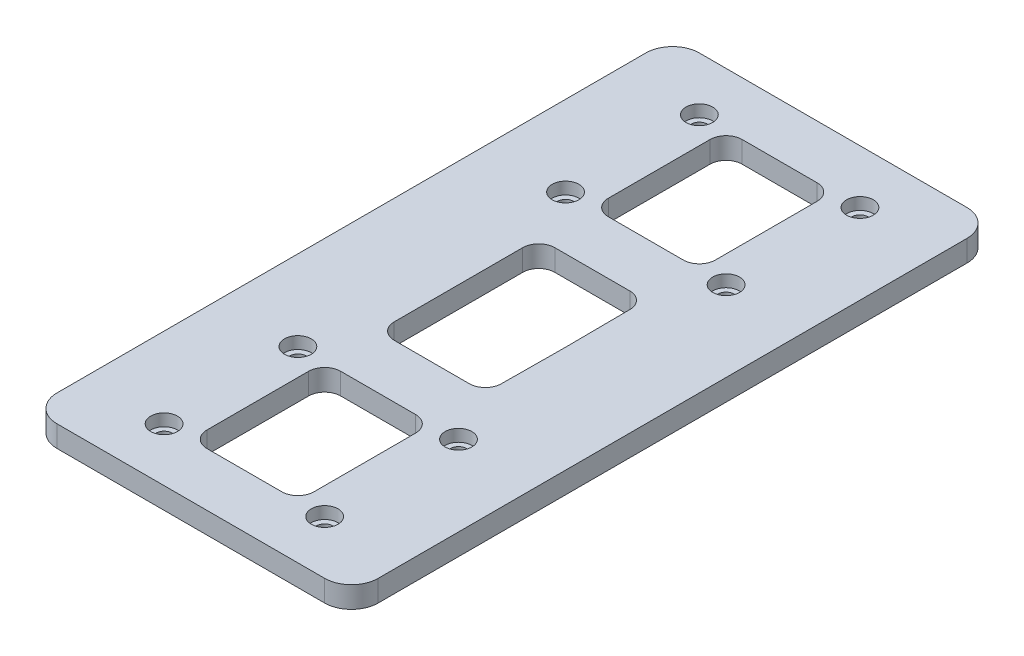
from build123d import *

# Parameters (mm, degrees)
SKETCH_1_R      = 2.5
EXTRUDE_1_DEPTH = 4
SKETCH_1_32_R   = 2.5
SKETCH_1_32_R_2 = 1.5
EXTRUDE_2_DEPTH = 1.75
SKETCH_1_33_R   = 2.5
SKETCH_1_33_R_2 = 1.5
EXTRUDE_3_DEPTH = 1.75


with BuildPart() as part:
    # 草图1 → 凸台-拉伸1 (new body)
    with BuildSketch(Plane(origin=(0, 0, 0), x_dir=(1, 0, 0), z_dir=(0, 1, 0))):
        with BuildLine():
            Line((-174.840079727, 131.119726246), (-199.840079727, 131.119726246))
            Line((-199.840079727, 131.119726246), (-224.840079727, 131.119726246))
            ThreePointArc((-224.840079727, 131.119726246), (-228.375613633, 129.655260152), (-229.840079727, 126.119726246))
            Line((-229.840079727, 126.119726246), (-229.840079727, 16.119726246))
            ThreePointArc((-229.840079727, 16.119726246), (-228.375613633, 12.58419234), (-224.840079727, 11.119726246))
            Line((-224.840079727, 11.119726246), (-199.840079727, 11.119726246))
            Line((-199.840079727, 11.119726246), (-174.840079727, 11.119726246))
            ThreePointArc((-174.840079727, 11.119726246), (-171.304545821, 12.58419234), (-169.840079727, 16.119726246))
            Line((-169.840079727, 16.119726246), (-169.840079727, 126.119726246))
            ThreePointArc((-169.840079727, 126.119726246), (-171.304545821, 129.655260152), (-174.840079727, 131.119726246))
        make_face()
        with Locations((-214.840082087, 21.119726246)):
            Circle(SKETCH_1_R, mode=Mode.SUBTRACT)
        with BuildLine():
            ThreePointArc((-192.840079727, 46.119726246), (-190.718759384, 45.241046589), (-189.840079727, 43.119726246))
            Line((-189.840079727, 43.119726246), (-189.840079727, 24.119726246))
            ThreePointArc((-189.840079727, 24.119726246), (-190.718759384, 21.998405902), (-192.840079727, 21.119726246))
            Line((-192.840079727, 21.119726246), (-206.840082087, 21.119726246))
            ThreePointArc((-206.840082087, 21.119726246), (-208.961402431, 21.998405902), (-209.840082087, 24.119726246))
            Line((-209.840082087, 24.119726246), (-209.840082087, 43.119726246))
            ThreePointArc((-209.840082087, 43.119726246), (-208.961402431, 45.241046589), (-206.840082087, 46.119726246))
            Line((-206.840082087, 46.119726246), (-192.840079727, 46.119726246))
        make_face(mode=Mode.SUBTRACT)
        with Locations((-214.840082087, 46.119726246)):
            Circle(SKETCH_1_R, mode=Mode.SUBTRACT)
        with Locations((-184.840079727, 21.119726246)):
            Circle(SKETCH_1_R, mode=Mode.SUBTRACT)
        with BuildLine():
            ThreePointArc((-206.840082087, 56.119726246), (-208.961402431, 56.998405902), (-209.840082087, 59.119726246))
            Line((-209.840082087, 59.119726246), (-209.840082087, 83.119726246))
            ThreePointArc((-209.840082087, 83.119726246), (-208.961402431, 85.241046589), (-206.840082087, 86.119726246))
            Line((-206.840082087, 86.119726246), (-192.818063372, 86.119726246))
            ThreePointArc((-192.818063372, 86.119726246), (-190.704569987, 85.248844775), (-189.818144754, 83.141823385))
            Line((-189.818144754, 83.141823385), (-189.729591033, 71.119726246))
            Line((-189.729591033, 71.119726246), (-189.818144754, 59.097629106))
            ThreePointArc((-189.818144754, 59.097629106), (-190.704569987, 56.990607717), (-192.818063372, 56.119726246))
            Line((-192.818063372, 56.119726246), (-206.840082087, 56.119726246))
        make_face(mode=Mode.SUBTRACT)
        with Locations((-184.840079727, 46.119726246)):
            Circle(SKETCH_1_R, mode=Mode.SUBTRACT)
        with Locations((-214.840082087, 96.119726246)):
            Circle(SKETCH_1_R, mode=Mode.SUBTRACT)
        with Locations((-214.840082087, 121.119726246)):
            Circle(SKETCH_1_R, mode=Mode.SUBTRACT)
        with BuildLine():
            Line((-192.840079727, 96.119726246), (-206.840082087, 96.119726246))
            ThreePointArc((-206.840082087, 96.119726246), (-208.961402431, 96.998405902), (-209.840082087, 99.119726246))
            Line((-209.840082087, 99.119726246), (-209.840082087, 118.119726246))
            ThreePointArc((-209.840082087, 118.119726246), (-208.961402431, 120.241046589), (-206.840082087, 121.119726246))
            Line((-206.840082087, 121.119726246), (-192.840079727, 121.119726246))
            ThreePointArc((-192.840079727, 121.119726246), (-190.718759384, 120.241046589), (-189.840079727, 118.119726246))
            Line((-189.840079727, 118.119726246), (-189.840079727, 99.119726246))
            ThreePointArc((-189.840079727, 99.119726246), (-190.718759384, 96.998405902), (-192.840079727, 96.119726246))
        make_face(mode=Mode.SUBTRACT)
        with Locations((-184.840079727, 96.119726246)):
            Circle(SKETCH_1_R, mode=Mode.SUBTRACT)
        with Locations((-184.840079727, 121.119726246)):
            Circle(SKETCH_1_R, mode=Mode.SUBTRACT)
    extrude(amount=EXTRUDE_1_DEPTH)

    # 草图1<32> → 凸台-拉伸2 (add)
    # profile 1 of 4: a face of its own
    with BuildSketch(Plane(origin=(0, 0, 0), x_dir=(1, 0, 0), z_dir=(0, 1, 0))):
        with Locations((-214.840082087, 96.119726246)):
            Circle(SKETCH_1_32_R)
        with Locations((-214.840082087, 96.119726246)):
            Circle(SKETCH_1_32_R_2, mode=Mode.SUBTRACT)
    # profile 2 of 4: a face of its own
    with BuildSketch(Plane(origin=(0, 0, 0), x_dir=(1, 0, 0), z_dir=(0, 1, 0))):
        with Locations((-184.840079727, 96.119726246)):
            Circle(SKETCH_1_32_R)
        with Locations((-184.840079727, 96.119726246)):
            Circle(SKETCH_1_32_R_2, mode=Mode.SUBTRACT)
    # profile 3 of 4: a face of its own
    with BuildSketch(Plane(origin=(0, 0, 0), x_dir=(1, 0, 0), z_dir=(0, 1, 0))):
        with Locations((-184.840079727, 121.119726246)):
            Circle(SKETCH_1_32_R)
        with Locations((-184.840079727, 121.119726246)):
            Circle(SKETCH_1_32_R_2, mode=Mode.SUBTRACT)
    # profile 4 of 4: a face of its own
    with BuildSketch(Plane(origin=(0, 0, 0), x_dir=(1, 0, 0), z_dir=(0, 1, 0))):
        with Locations((-214.840082087, 121.119726246)):
            Circle(SKETCH_1_32_R)
        with Locations((-214.840082087, 121.119726246)):
            Circle(SKETCH_1_32_R_2, mode=Mode.SUBTRACT)
    extrude(amount=EXTRUDE_2_DEPTH)

    # 草图1<33> → 凸台-拉伸3 (add)
    # profile 1 of 4: a face of its own
    with BuildSketch(Plane(origin=(0, 0, 0), x_dir=(1, 0, 0), z_dir=(0, 1, 0))):
        with Locations((-214.840082087, 21.119726246)):
            Circle(SKETCH_1_33_R)
        with Locations((-214.840082087, 21.119726246)):
            Circle(SKETCH_1_33_R_2, mode=Mode.SUBTRACT)
    # profile 2 of 4: a face of its own
    with BuildSketch(Plane(origin=(0, 0, 0), x_dir=(1, 0, 0), z_dir=(0, 1, 0))):
        with Locations((-184.840079727, 21.119726246)):
            Circle(SKETCH_1_33_R)
        with Locations((-184.840079727, 21.119726246)):
            Circle(SKETCH_1_33_R_2, mode=Mode.SUBTRACT)
    # profile 3 of 4: a face of its own
    with BuildSketch(Plane(origin=(0, 0, 0), x_dir=(1, 0, 0), z_dir=(0, 1, 0))):
        with Locations((-184.840079727, 46.119726246)):
            Circle(SKETCH_1_33_R)
        with Locations((-184.840079727, 46.119726246)):
            Circle(SKETCH_1_33_R_2, mode=Mode.SUBTRACT)
    # profile 4 of 4: a face of its own
    with BuildSketch(Plane(origin=(0, 0, 0), x_dir=(1, 0, 0), z_dir=(0, 1, 0))):
        with Locations((-214.840082087, 46.119726246)):
            Circle(SKETCH_1_33_R)
        with Locations((-214.840082087, 46.119726246)):
            Circle(SKETCH_1_33_R_2, mode=Mode.SUBTRACT)
    extrude(amount=EXTRUDE_3_DEPTH)


solid = part.part
